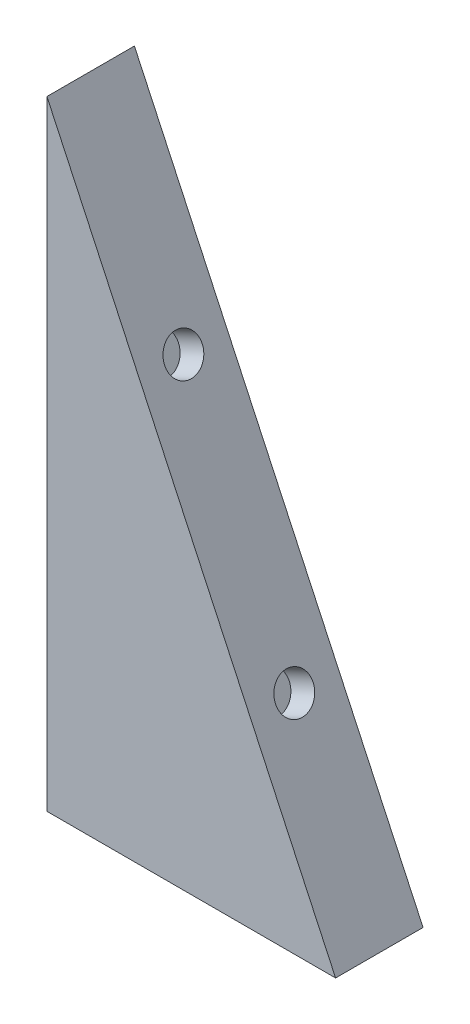
from build123d import *

# Parameters (mm, degrees)
BOSS_EXTRUDE1_DEPTH = 10
SKETCH2_W           = 5.8
SKETCH2_H           = 3.8
BOSS_EXTRUDE2_DEPTH = 2
SKETCH3_R           = 2.15
CUT_EXTRUDE1_DEPTH  = 12
CUT_EXTRUDE2_DEPTH  = 6.5
SKETCH5_W           = 7.6
SKETCH5_H           = 3.5
CUT_EXTRUDE3_DEPTH  = 6.5
SKETCH6_R           = 2.15
CUT_EXTRUDE4_DEPTH  = 7.3
CUT_EXTRUDE5_START  = -10
CUT_EXTRUDE5_DEPTH  = 7.5
SKETCH8_W           = 7.6
SKETCH8_H           = 3.5
CUT_EXTRUDE6_DEPTH  = 8.75


with BuildPart() as part:
    # Sketch1 → Boss-Extrude1 (new body)
    with BuildSketch(Plane.XY):
        Polygon((0, 70.768728377), (0, 0), (33, 0), align=None)
    extrude(amount=BOSS_EXTRUDE1_DEPTH)

    # Sketch2 → Boss-Extrude2 (add)
    with BuildSketch(Plane(origin=(0, 0, 0), x_dir=(-1, 0, 0), z_dir=(0, -1, 0))):
        with Locations((-16.5, -5)):
            Rectangle(SKETCH2_W, SKETCH2_H)
    extrude(amount=BOSS_EXTRUDE2_DEPTH)

    # Sketch3 → Cut-Extrude1 (cut)
    with BuildSketch(Plane(origin=(0, 0, 0), x_dir=(-1, 0, 0), z_dir=(0, -1, 0))):
        with Locations(Location((-23.331538291, -4, 0), (0, 0, 180))):
            Circle(SKETCH3_R)
        with Locations(Location((-8.551538291, -4, 0), (0, 0, 180))):
            Circle(SKETCH3_R)
    extrude(amount=-CUT_EXTRUDE1_DEPTH, mode=Mode.SUBTRACT)

    # Sketch4 → Cut-Extrude2 (cut)
    with BuildSketch(Plane(origin=(0, 0, 0), x_dir=(-1, 0, 0), z_dir=(0, 0, -1))):
        Polygon((-19.531538291, 3.25), (-19.531538291, 5), (-19.531538291, 6.75), (-27.131538291, 6.75), (-27.131538291, 5), (-27.131538291, 3.25), align=None)
    extrude(amount=-CUT_EXTRUDE2_DEPTH, mode=Mode.SUBTRACT)

    # Sketch5 → Cut-Extrude3 (cut)
    with BuildSketch(Plane(origin=(0, 0, 0), x_dir=(-1, 0, 0), z_dir=(0, 0, -1))):
        with Locations((-23.331538291, 5)):
            Rectangle(SKETCH5_W, SKETCH5_H)
        with Locations((-8.551538291, 5)):
            Rectangle(SKETCH5_W, SKETCH5_H)
    extrude(amount=-CUT_EXTRUDE3_DEPTH, mode=Mode.SUBTRACT)

    # Sketch6 → Cut-Extrude4 (cut)
    with BuildSketch(Plane(origin=(27.10599556, 12.639733311, 0), x_dir=(0, 0, -1), z_dir=(0.9063077870366479, 0.422618261740704, 0))):
        with Locations(Location((-5, 9.053597363, 0), (0, 0, 90))):
            Circle(SKETCH6_R)
        with Locations(Location((-5, 39.053597363, 0), (0, 0, 90))):
            Circle(SKETCH6_R)
    extrude(amount=-CUT_EXTRUDE4_DEPTH, mode=Mode.SUBTRACT)

    # Sketch7 → Cut-Extrude5 (cut)
    with BuildSketch(Plane.XY.offset(10).offset(CUT_EXTRUDE5_START)):
        Polygon((6.247556837, 50.199361906), (3.358673988, 48.823005888), (6.627519532, 41.961909123), (9.51640238, 43.338265141), align=None)
        Polygon((18.982454602, 23.03825064), (22.13718624, 16.123941687), (19.225898259, 14.795633629), (16.071166622, 21.709942582), align=None)
    extrude(amount=CUT_EXTRUDE5_DEPTH, mode=Mode.SUBTRACT)

    # Sketch8 → Cut-Extrude6 (cut)
    with BuildSketch(Plane(origin=(0, 0, 0), x_dir=(-1, 0, 0), z_dir=(0, 0, -1))):
        with Locations((-23.331538291, 5)):
            Rectangle(SKETCH8_W, SKETCH8_H)
        with Locations((-8.551538291, 5)):
            Rectangle(SKETCH8_W, SKETCH8_H)
        Polygon((-22.13718624, 16.123941687), (-19.225898259, 14.795633629), (-16.071166622, 21.709942582), (-18.982454602, 23.03825064), align=None)
        Polygon((-9.51640238, 43.338265141), (-6.627519532, 41.961909123), (-3.358673988, 48.823005888), (-6.247556837, 50.199361906), align=None)
    extrude(amount=-CUT_EXTRUDE6_DEPTH, mode=Mode.SUBTRACT)


solid = part.part
